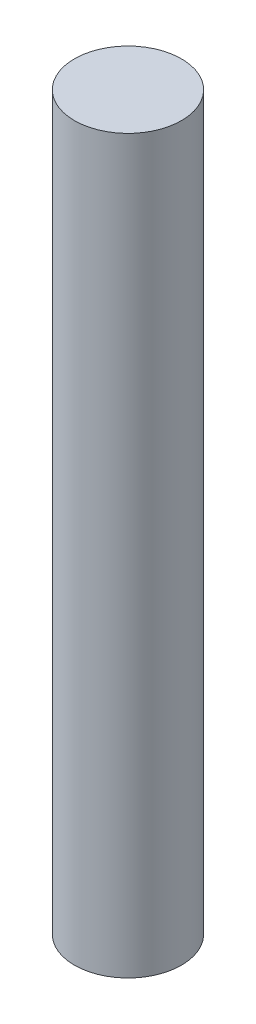
from build123d import *

# Parameters (mm, degrees)
SKETCH1_R           = 3
BOSS_EXTRUDE1_DEPTH = 41


with BuildPart() as part:
    # Sketch1 → Boss-Extrude1 (new body)
    with BuildSketch(Plane(origin=(0, 0, 0), x_dir=(1, 0, 0), z_dir=(0, 1, 0))):
        with Locations(Location((0, 0, 0), (0, 0, 270))):
            Circle(SKETCH1_R)
    extrude(amount=BOSS_EXTRUDE1_DEPTH)


solid = part.part
